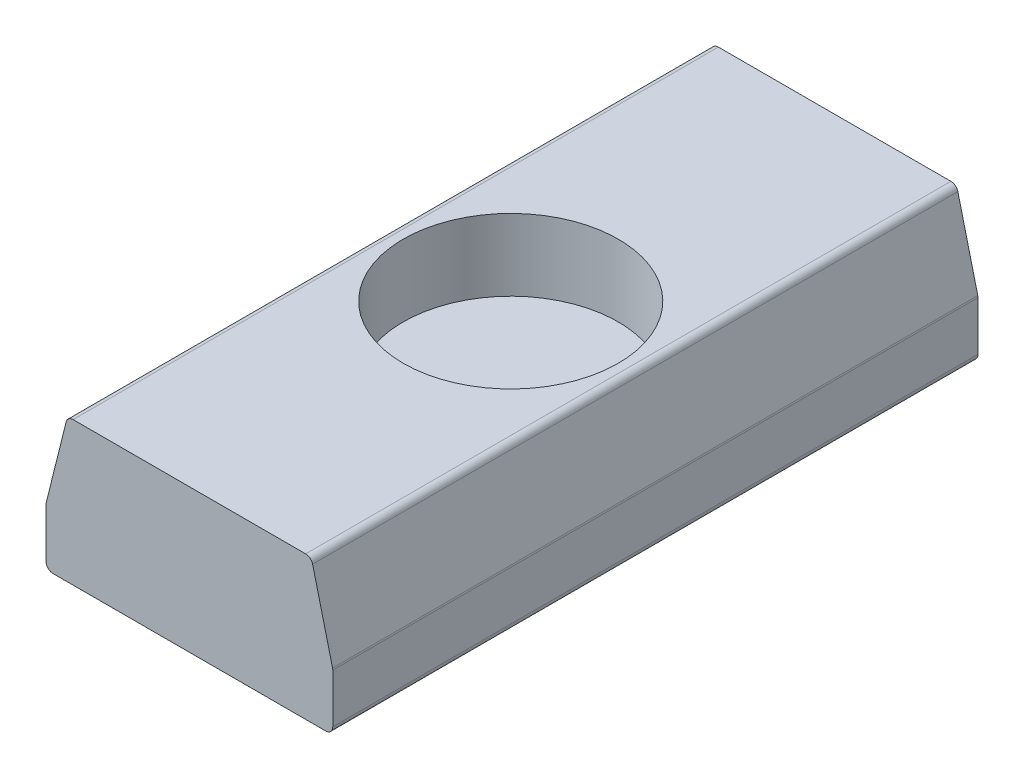
from build123d import *

# Parameters (mm, degrees)
BOSS_EXTRUDE1_DEPTH = 90
FILLET1_R           = 1
SKETCH2_R           = 15
CUT_EXTRUDE1_DEPTH  = 10


with BuildPart() as part:
    # Sketch1 → Boss-Extrude1 (new body)
    with BuildSketch(Plane.XY):
        Polygon((-20, -2.032342801), (-20, -10), (20, -10), (20, -2.032342801), (17, 10), (-17, 10), align=None)
    extrude(amount=BOSS_EXTRUDE1_DEPTH)

    # Fillet1
    fillet1_edges = [part.edges().sort_by_distance(p)[0] for p in [
        (17, 10, 45),
        (20, -2.032342801, 45),
        (20, -10, 45),
        (-20, -10, 45),
        (-20, -2.032342801, 45),
        (-17, 10, 45),
    ]]
    fillet(fillet1_edges, radius=FILLET1_R)

    # Sketch2 → Cut-Extrude1 (cut)
    with BuildSketch(Plane(origin=(0, 10, 0), x_dir=(1, 0, 0), z_dir=(0, 1, 0))):
        with Locations(Location((0, -45.17837191, 0), (0, 0, 270))):
            Circle(SKETCH2_R)
    extrude(amount=-CUT_EXTRUDE1_DEPTH, mode=Mode.SUBTRACT)


solid = part.part
